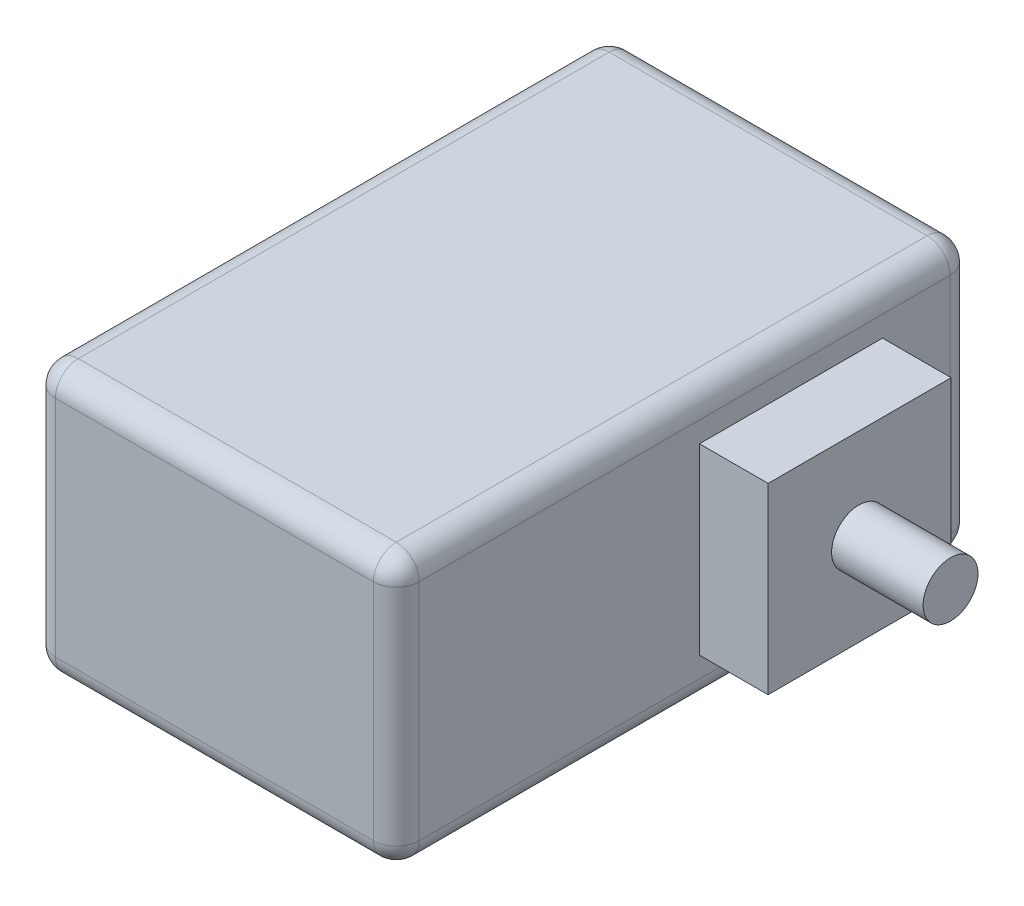
from build123d import *

# Parameters (mm, degrees)
SKETCH1_W           = 159
SKETCH1_H           = 118
BOSS_EXTRUDE1_DEPTH = 126
FILLET1_R           = 10
SKETCH6_W           = 80
SKETCH6_H           = 80
BOSS_EXTRUDE2_DEPTH = 30
SKETCH7_R           = 12
BOSS_EXTRUDE3_DEPTH = 40
SKETCH11_R          = 8.5
SKETCH11_R_2        = 10.5
CUT_EXTRUDE5_DEPTH  = 50
SKETCH12_R          = 7.94064545
CUT_EXTRUDE6_DEPTH  = 10


with BuildPart() as part:
    # Sketch1 → Boss-Extrude1 (new, symmetric)
    with BuildSketch(Plane.XY):
        Rectangle(SKETCH1_W, SKETCH1_H)
    extrude(amount=BOSS_EXTRUDE1_DEPTH, both=True)

    # Fillet1
    fillet1_edges = [part.edges().sort_by_distance(p)[0] for p in [
        (-79.5, 0, 126),
        (0, -59, 126),
        (79.5, 0, 126),
        (0, -59, -126),
        (-79.5, 0, -126),
        (0, 59, -126),
        (79.5, 0, -126),
        (0, 59, 126),
        (79.5, -59, 0),
        (-79.5, -59, 0),
        (-79.5, 59, 0),
        (79.5, 59, 0),
    ]]
    fillet(fillet1_edges, radius=FILLET1_R)

    # Sketch6 → Boss-Extrude2 (add)
    with BuildSketch(Plane(origin=(79.5, 0, 0), x_dir=(0, 0, -1), z_dir=(1, 0, 0))):
        with Locations((46.5, 0)):
            Rectangle(SKETCH6_W, SKETCH6_H)
    extrude(amount=BOSS_EXTRUDE2_DEPTH)

    # Sketch7 → Boss-Extrude3 (add)
    with BuildSketch(Plane(origin=(109.5, 0, 0), x_dir=(0, 0, -1), z_dir=(1, 0, 0))):
        with Locations((46.238380337, 0)):
            Circle(SKETCH7_R)
    extrude(amount=BOSS_EXTRUDE3_DEPTH)

    # Sketch11 → Cut-Extrude5 (cut)
    with BuildSketch(Plane.ZY.offset(79.5)):
        with Locations((93.08230214, 26.75)):
            Circle(SKETCH11_R)
        with Locations((93.08230214, -26.75)):
            Circle(SKETCH11_R_2)
    extrude(amount=-CUT_EXTRUDE5_DEPTH, mode=Mode.SUBTRACT)

    # Sketch12 → Cut-Extrude6 (cut)
    with BuildSketch(Plane.XZ.offset(59)):
        with Locations(Location((-38.5, -84, 0), (0, 0, 270))):
            Circle(SKETCH12_R)
        with Locations(Location((56.5, -84, 0), (0, 0, 270))):
            Circle(SKETCH12_R)
        with Locations(Location((56.5, -9, 0), (0, 0, 270))):
            Circle(SKETCH12_R)
        with Locations(Location((-38.5, -9, 0), (0, 0, 270))):
            Circle(SKETCH12_R)
    extrude(amount=-CUT_EXTRUDE6_DEPTH, mode=Mode.SUBTRACT)


solid = part.part
